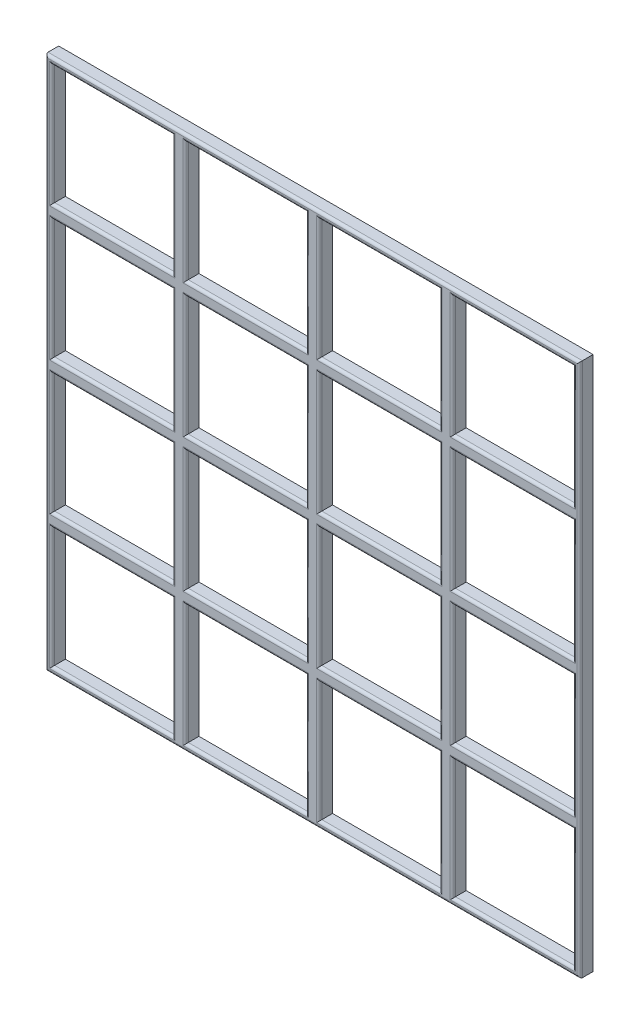
from build123d import *

# Parameters (mm, degrees)
SKETCH2_W           = 200
SKETCH2_H           = 200
SKETCH2_W_2         = 45
SKETCH2_H_2         = 45
BOSS_EXTRUDE1_DEPTH = 5
FILLET2_R           = 1


with BuildPart() as part:
    # Sketch2 → Boss-Extrude1 (new body)
    with BuildSketch(Plane.XY):
        Rectangle(SKETCH2_W, SKETCH2_H)
        with Locations((-25, -75)):
            Rectangle(SKETCH2_W_2, SKETCH2_H_2, mode=Mode.SUBTRACT)
        with Locations((-75, 75)):
            Rectangle(SKETCH2_W_2, SKETCH2_H_2, mode=Mode.SUBTRACT)
        with Locations((-75, -75)):
            Rectangle(SKETCH2_W_2, SKETCH2_H_2, mode=Mode.SUBTRACT)
        with Locations((25, -75)):
            Rectangle(SKETCH2_W_2, SKETCH2_H_2, mode=Mode.SUBTRACT)
        with Locations((75, -75)):
            Rectangle(SKETCH2_W_2, SKETCH2_H_2, mode=Mode.SUBTRACT)
        with Locations((-25, 75)):
            Rectangle(SKETCH2_W_2, SKETCH2_H_2, mode=Mode.SUBTRACT)
        with Locations((75, -25)):
            Rectangle(SKETCH2_W_2, SKETCH2_H_2, mode=Mode.SUBTRACT)
        with Locations((75, 25)):
            Rectangle(SKETCH2_W_2, SKETCH2_H_2, mode=Mode.SUBTRACT)
        with Locations((25, 75)):
            Rectangle(SKETCH2_W_2, SKETCH2_H_2, mode=Mode.SUBTRACT)
        with Locations((75, 75)):
            Rectangle(SKETCH2_W_2, SKETCH2_H_2, mode=Mode.SUBTRACT)
        with Locations((-75, -25)):
            Rectangle(SKETCH2_W_2, SKETCH2_H_2, mode=Mode.SUBTRACT)
        with Locations((-75, 25)):
            Rectangle(SKETCH2_W_2, SKETCH2_H_2, mode=Mode.SUBTRACT)
        with Locations((25, -25)):
            Rectangle(SKETCH2_W_2, SKETCH2_H_2, mode=Mode.SUBTRACT)
        with Locations((-25, -25)):
            Rectangle(SKETCH2_W_2, SKETCH2_H_2, mode=Mode.SUBTRACT)
        with Locations((-25, 25)):
            Rectangle(SKETCH2_W_2, SKETCH2_H_2, mode=Mode.SUBTRACT)
        with Locations((25, 25)):
            Rectangle(SKETCH2_W_2, SKETCH2_H_2, mode=Mode.SUBTRACT)
    extrude(amount=BOSS_EXTRUDE1_DEPTH)

    # Fillet2
    fillet2_edges = [part.edges().sort_by_distance(p)[0] for p in [
        (75, -2.5, 5),
        (52.5, -25, 5),
        (75, -47.5, 5),
        (97.5, -25, 5),
        (25, 47.5, 5),
        (2.5, 25, 5),
        (25, 2.5, 5),
        (47.5, 25, 5),
        (-100, 0, 5),
        (75, 47.5, 5),
        (52.5, 25, 5),
        (75, 2.5, 5),
        (97.5, 25, 5),
        (-25, 97.5, 5),
        (-47.5, 75, 5),
        (-25, 52.5, 5),
        (-2.5, 75, 5),
        (47.5, 75, 5),
        (25, 97.5, 5),
        (2.5, 75, 5),
        (25, 52.5, 5),
        (47.5, -25, 5),
        (0, -100, 5),
        (25, -2.5, 5),
        (97.5, 75, 5),
        (75, 97.5, 5),
        (52.5, 75, 5),
        (75, 52.5, 5),
        (2.5, -25, 5),
        (25, -47.5, 5),
        (-52.5, -25, 5),
        (-75, -2.5, 5),
        (-97.5, -25, 5),
        (-75, -47.5, 5),
        (-52.5, 25, 5),
        (-75, 47.5, 5),
        (-97.5, 25, 5),
        (-75, 2.5, 5),
        (-75, 97.5, 5),
        (-97.5, 75, 5),
        (-75, 52.5, 5),
        (-52.5, 75, 5),
        (-52.5, -75, 5),
        (-75, -52.5, 5),
        (-97.5, -75, 5),
        (-75, -97.5, 5),
        (-25, 47.5, 5),
        (-47.5, 25, 5),
        (-25, 2.5, 5),
        (-2.5, 25, 5),
        (100, 0, 5),
        (-25, -52.5, 5),
        (-47.5, -75, 5),
        (-25, -97.5, 5),
        (-2.5, -75, 5),
        (25, -52.5, 5),
        (2.5, -75, 5),
        (25, -97.5, 5),
        (47.5, -75, 5),
        (75, -52.5, 5),
        (52.5, -75, 5),
        (75, -97.5, 5),
        (97.5, -75, 5),
        (0, 100, 5),
        (-2.5, -25, 5),
        (-25, -2.5, 5),
        (-47.5, -25, 5),
        (-25, -47.5, 5),
    ]]
    fillet(fillet2_edges, radius=FILLET2_R)


solid = part.part
